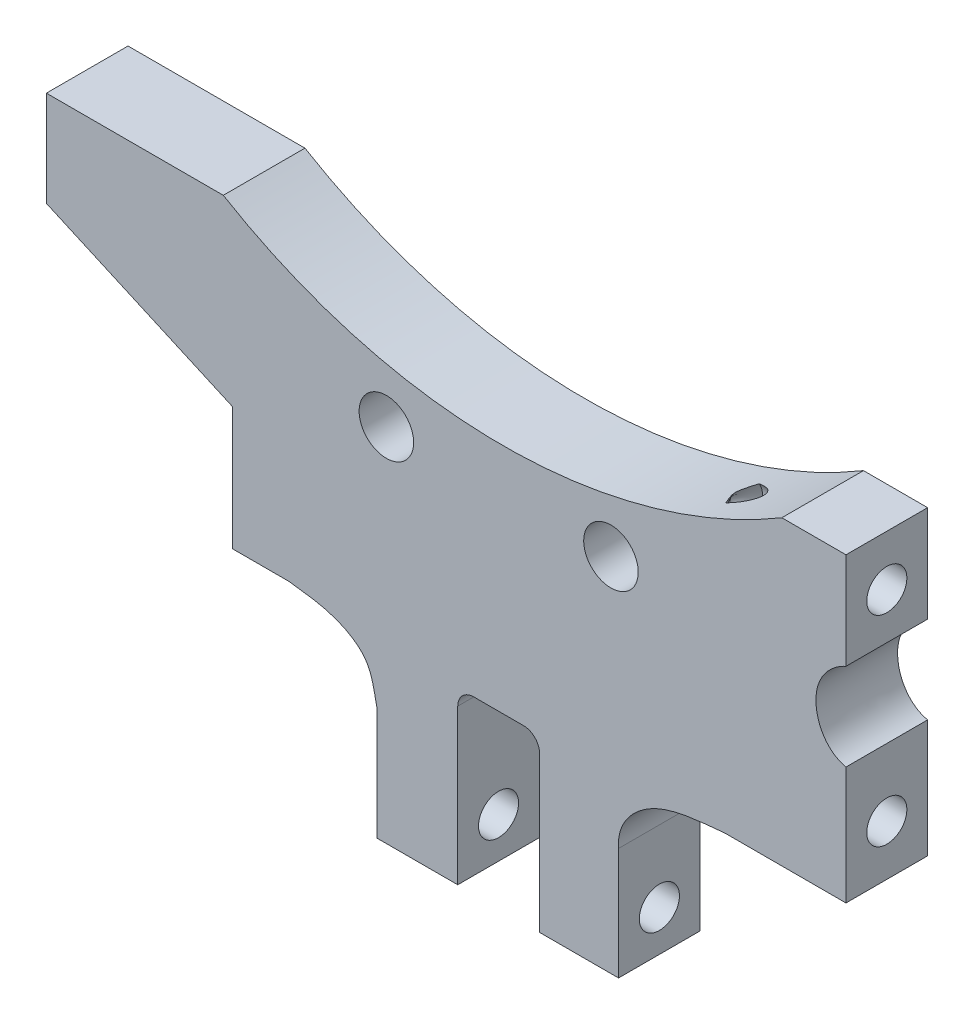
from build123d import *

# Parameters (mm, degrees)
ESTRUSIONE_ESTRUSIONE1_DEPTH           = 5.09
FORO_SVASATO_PER_VITE_M3_1_D           = 3.4
FORO_SVASATO_PER_VITE_M3_1_CSINK_D     = 6.3
FORO_SVASATO_PER_VITE_M3_1_CSINK_ANGLE = 90
FORO_FILETTATO_M3X0_5_1_D              = 2.5
FORO_FILETTATO_M3X0_5_1_DEPTH          = 9
FORO_FILETTATO_M3X0_5_1_TIP            = 0.751075774
FORO_FILETTATO_M3X0_5_2_D              = 2.5
FORO_FILETTATO_M3X0_5_2_DEPTH          = 9
FORO_FILETTATO_M3X0_5_2_TIP            = 0.751075774
FORO_FILETTATO_M3X0_5_3_D              = 2.5
FORO_FILETTATO_M3X0_5_3_DEPTH          = 9
FORO_FILETTATO_M3X0_5_3_TIP            = 0.751075774
FORO_FILETTATO_M3X0_5_4_D              = 2.5


with BuildPart() as part:
    # Schizzo2 → Estrusione-Estrusione1 (new body)
    with BuildSketch(Plane.XY):
        with BuildLine():
            Line((13.408661509, 34.046761388), (25.008661509, 28.874777457))
            Line((25.008661509, 28.874777457), (25.008661509, 21.197917302))
            Line((25.008661509, 21.197917302), (28.539563234, 21.197917302))
            add(Edge.make_bspline(
                [(28.539563234, 21.197917302), (29.672665245, 21.054672347), (31.442336464, 20.883728728), (33.709967859, 19.337881701), (33.860174007, 17.780017142), (34.031169837, 17.055524547)],
                knots=[0, 0, 0, 0, 0.44666859, 0.69482561, 1, 1, 1, 1], degree=3))
            Line((34.031169837, 17.055524547), (34.031169837, 10.079137282))
            Line((34.031169837, 10.079137282), (39.054168668, 10.079137282))
            Line((39.054168668, 10.079137282), (39.054168668, 19.723110995))
            ThreePointArc((39.054168668, 19.723110995), (39.347061887, 20.430217776), (40.054168668, 20.723110995))
            Line((40.054168668, 20.723110995), (43.156897639, 20.723110995))
            ThreePointArc((43.156897639, 20.723110995), (43.86400442, 20.430217776), (44.156897639, 19.723110995))
            Line((44.156897639, 19.723110995), (44.156897639, 10.059204747))
            Line((44.156897639, 10.059204747), (49.080233794, 10.059204747))
            Line((49.080233794, 10.059204747), (49.080233794, 17.055524547))
            add(Edge.make_bspline(
                [(49.080233794, 17.055524547), (48.967324691, 18.346340588), (50.999627836, 20.921028345), (54.113128084, 21.035559742), (55.71736734, 21.197917302)],
                knots=[0, 0, 0, 0, 0.423714054, 1, 1, 1, 1], degree=3))
            Line((55.71736734, 21.197917302), (63.258661509, 21.197917302))
            Line((63.258661509, 21.197917302), (63.258661509, 28.539967348))
            add(Edge.make_bspline(
                [(63.258661509, 28.539967348), (62.239722551, 28.759416988), (61.253896648, 30.182238688), (61.448846017, 32.629580504), (62.536492347, 33.654111413), (63.258661509, 33.978194592)],
                knots=[0, 0, 0, 0, 0.415878439, 0.65656192, 1, 1, 1, 1], degree=3))
            Line((63.258661509, 33.978194592), (63.258661509, 39.997917302))
            Line((63.258661509, 39.997917302), (59.258661509, 39.997917302))
            ThreePointArc((59.258661509, 39.997917302), (41.848661509, 35.197917302), (24.438661509, 39.997917302))
            Line((24.438661509, 39.997917302), (13.408661509, 39.997917302))
            Line((13.408661509, 39.997917302), (13.408661509, 34.046761388))
        make_face()
    extrude(amount=ESTRUSIONE_ESTRUSIONE1_DEPTH)

    # Foro svasato per Vite M3-1 (through all)
    with Locations(Plane(origin=(0, 0, 0), x_dir=(-1, 0, 0), z_dir=(0, 0, -1))):
        with Locations((-48.605533153, 32.579137282), (-34.605533153, 32.579137282)):
            CounterSinkHole(FORO_SVASATO_PER_VITE_M3_1_D / 2, FORO_SVASATO_PER_VITE_M3_1_CSINK_D / 2, counter_sink_angle=FORO_SVASATO_PER_VITE_M3_1_CSINK_ANGLE)

    # Foro filettato M3x0.5-1
    with Locations(Plane(origin=(63.258661509, 0, 0), x_dir=(0, 0, -1), z_dir=(1, 0, 0))):
        with Locations((-2.545, 36.847917302), (-2.545, 24.347917302)):
            Hole(FORO_FILETTATO_M3X0_5_1_D / 2, depth=FORO_FILETTATO_M3X0_5_1_DEPTH)
            with Locations((0, 0, -(FORO_FILETTATO_M3X0_5_1_DEPTH + FORO_FILETTATO_M3X0_5_1_TIP / 2))):  # 118° drill point
                Cone(0, FORO_FILETTATO_M3X0_5_1_D / 2, FORO_FILETTATO_M3X0_5_1_TIP, mode=Mode.SUBTRACT)

    # Foro filettato M3x0.5-2
    with Locations(Plane.ZY.offset(-13.408661509)):
        with Locations((2.545, 36.847917302)):
            Hole(FORO_FILETTATO_M3X0_5_2_D / 2, depth=FORO_FILETTATO_M3X0_5_2_DEPTH)
            with Locations((0, 0, -(FORO_FILETTATO_M3X0_5_2_DEPTH + FORO_FILETTATO_M3X0_5_2_TIP / 2))):  # 118° drill point
                Cone(0, FORO_FILETTATO_M3X0_5_2_D / 2, FORO_FILETTATO_M3X0_5_2_TIP, mode=Mode.SUBTRACT)

    # Foro filettato M3x0.5-3
    with Locations(Plane.ZY.offset(-25.008661509)):
        with Locations((2.545, 24.347917302)):
            Hole(FORO_FILETTATO_M3X0_5_3_D / 2, depth=FORO_FILETTATO_M3X0_5_3_DEPTH)
            with Locations((0, 0, -(FORO_FILETTATO_M3X0_5_3_DEPTH + FORO_FILETTATO_M3X0_5_3_TIP / 2))):  # 118° drill point
                Cone(0, FORO_FILETTATO_M3X0_5_3_D / 2, FORO_FILETTATO_M3X0_5_3_TIP, mode=Mode.SUBTRACT)

    # Foro filettato M3x0.5-4 (through all)
    with Locations(Plane(origin=(49.080233794, 0, 0), x_dir=(0, 0, -1), z_dir=(1, 0, 0))):
        with Locations((-2.545, 12.604204747)):
            Hole(FORO_FILETTATO_M3X0_5_4_D / 2)


solid = part.part
